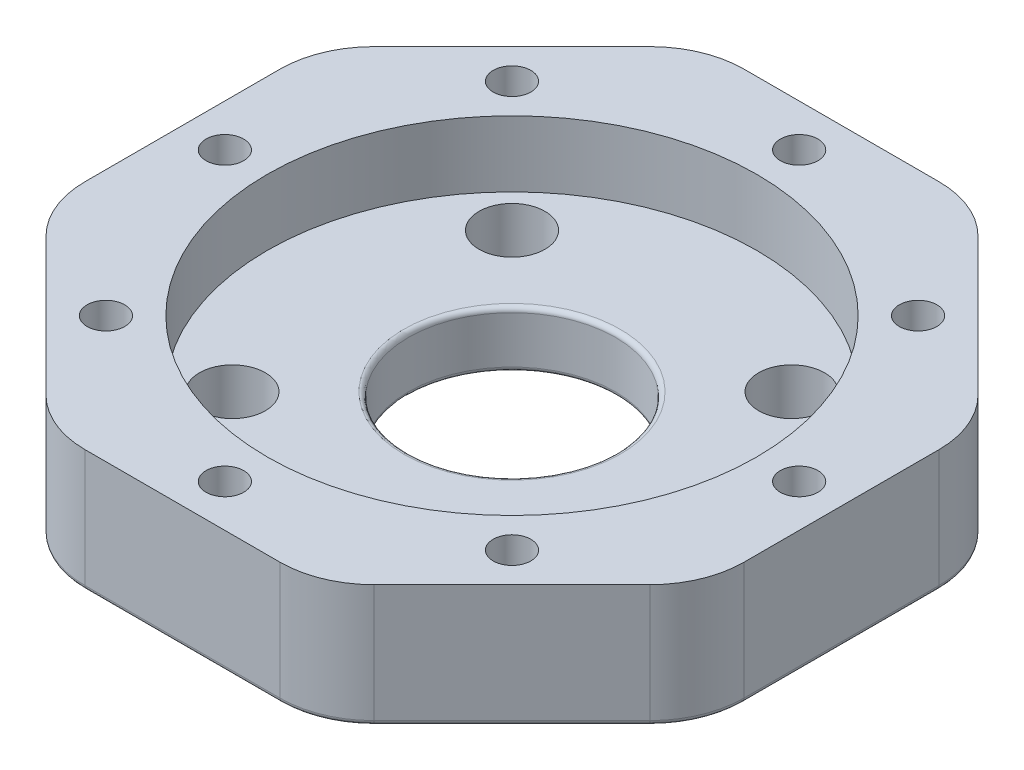
from build123d import *

# Parameters (mm, degrees)
SKETCH1_R           = 32
BOSS_EXTRUDE1_DEPTH = 13
SKETCH2_R           = 27
CUT_EXTRUDE1_DEPTH  = 7
SKETCH3_R           = 2.5
CUT_EXTRUDE2_DEPTH  = 46.793012567
SKETCH4_R           = 3.5
CUT_EXTRUDE3_DEPTH  = 5
BOSS_EXTRUDE2_START = 7
SKETCH7_R           = 27
SKETCH7_R_2         = 26
BOSS_EXTRUDE2_DEPTH = 7
SKETCH8_R           = 11
CUT_EXTRUDE6_DEPTH  = 46.793012567
FILLET2_R           = 0.5
SKETCH10_R          = 32
BOSS_EXTRUDE3_DEPTH = 13
SKETCH11_R          = 2
CUT_EXTRUDE9_DEPTH  = 52.176166328
FILLET3_R           = 0.5
SKETCH5_R           = 2
CUT_EXTRUDE11_DEPTH = 52.176166464
CUT_EXTRUDE12_DEPTH = 3


with BuildPart() as part:
    # Sketch1 → Boss-Extrude1 (new body)
    with BuildSketch(Plane(origin=(0, 0, 0), x_dir=(1, 0, 0), z_dir=(0, 1, 0))):
        with Locations(Location((0, 0, 0), (0, 0, 90))):
            Circle(SKETCH1_R)
    extrude(amount=BOSS_EXTRUDE1_DEPTH)

    # Sketch2 → Cut-Extrude1 (cut)
    with BuildSketch(Plane(origin=(0, 13, 0), x_dir=(1, 0, 0), z_dir=(0, 1, 0))):
        with Locations(Location((0, 0, 0), (0, 0, 270))):
            Circle(SKETCH2_R)
    extrude(amount=-CUT_EXTRUDE1_DEPTH, mode=Mode.SUBTRACT)

    # Sketch3 → Cut-Extrude2 (cut, through all)
    with BuildSketch(Plane(origin=(0, 6, 0), x_dir=(1, 0, 0), z_dir=(0, 1, 0))):
        with Locations(Location((-14.849242405, 14.849242405, 0), (0, 0, 270))):
            Circle(SKETCH3_R)
        with Locations(Location((14.849242405, 14.849242405, 0), (0, 0, 270))):
            Circle(SKETCH3_R)
        with Locations(Location((14.849242405, -14.849242405, 0), (0, 0, 270))):
            Circle(SKETCH3_R)
        with Locations(Location((-14.849242405, -14.849242405, 0), (0, 0, 270))):
            Circle(SKETCH3_R)
    extrude(amount=-CUT_EXTRUDE2_DEPTH, mode=Mode.SUBTRACT)

    # Sketch4 → Cut-Extrude3 (cut)
    with BuildSketch(Plane(origin=(0, 6, 0), x_dir=(1, 0, 0), z_dir=(0, 1, 0))):
        with Locations(Location((-14.849242405, 14.849242405, 0), (0, 0, 270))):
            Circle(SKETCH4_R)
        with Locations(Location((14.849242405, 14.849242405, 0), (0, 0, 270))):
            Circle(SKETCH4_R)
        with Locations(Location((14.849242405, -14.849242405, 0), (0, 0, 270))):
            Circle(SKETCH4_R)
        with Locations(Location((-14.849242405, -14.849242405, 0), (0, 0, 270))):
            Circle(SKETCH4_R)
    extrude(amount=-CUT_EXTRUDE3_DEPTH, mode=Mode.SUBTRACT)

    # Sketch7 → Boss-Extrude2 (add)
    with BuildSketch(Plane(origin=(0, 6, 0), x_dir=(1, 0, 0), z_dir=(0, 1, 0)).offset(BOSS_EXTRUDE2_START)):
        Circle(SKETCH7_R)
        with Locations(Location((0, 0, 0), (0, 0, 270))):
            Circle(SKETCH7_R_2, mode=Mode.SUBTRACT)
    extrude(amount=-BOSS_EXTRUDE2_DEPTH)

    # Sketch8 → Cut-Extrude6 (cut, through all)
    with BuildSketch(Plane(origin=(0, 6, 0), x_dir=(1, 0, 0), z_dir=(0, 1, 0))):
        with Locations(Location((0, 0, 0), (0, 0, 270))):
            Circle(SKETCH8_R)
    extrude(amount=-CUT_EXTRUDE6_DEPTH, mode=Mode.SUBTRACT)

    # Fillet2
    fillet2_edges = [part.edges().sort_by_distance(p)[0] for p in [
        (0, 0, -11),
        (0, 6, -11),
    ]]
    fillet(fillet2_edges, radius=FILLET2_R)

    # Sketch10 → Boss-Extrude3 (add)
    with BuildSketch(Plane(origin=(0, 0, 0), x_dir=(1, 0, 0), z_dir=(0, 1, 0))):
        with BuildLine():
            Line((10.355339059, 35), (-10.355339059, 35))
            ThreePointArc((-10.355339059, 35), (-14.182173383, 34.238795325), (-17.426406871, 32.071067812))
            Line((-17.426406871, 32.071067812), (-32.071067812, 17.426406871))
            ThreePointArc((-32.071067812, 17.426406871), (-34.238795325, 14.182173383), (-35, 10.355339059))
            Line((-35, 10.355339059), (-35, -10.355339059))
            ThreePointArc((-35, -10.355339059), (-34.238795325, -14.182173383), (-32.071067812, -17.426406871))
            Line((-32.071067812, -17.426406871), (-17.426406871, -32.071067812))
            ThreePointArc((-17.426406871, -32.071067812), (-14.182173383, -34.238795325), (-10.355339059, -35))
            Line((-10.355339059, -35), (10.355339059, -35))
            ThreePointArc((10.355339059, -35), (14.182173383, -34.238795325), (17.426406871, -32.071067812))
            Line((17.426406871, -32.071067812), (32.071067812, -17.426406871))
            ThreePointArc((32.071067812, -17.426406871), (34.238795325, -14.182173383), (35, -10.355339059))
            Line((35, -10.355339059), (35, 10.355339059))
            ThreePointArc((35, 10.355339059), (34.238795325, 14.182173383), (32.071067812, 17.426406871))
            Line((32.071067812, 17.426406871), (17.426406871, 32.071067812))
            ThreePointArc((17.426406871, 32.071067812), (14.182173383, 34.238795325), (10.355339059, 35))
        make_face()
        Circle(SKETCH10_R, mode=Mode.SUBTRACT)
    extrude(amount=BOSS_EXTRUDE3_DEPTH)

    # Sketch11 → Cut-Extrude9 (cut, through all)
    with BuildSketch(Plane(origin=(0, 13, 0), x_dir=(1, 0, 0), z_dir=(0, 1, 0))):
        with Locations(Location((-21.566756826, 21.566756826, 0), (0, 0, 270))):
            Circle(SKETCH11_R)
        with Locations(Location((21.566756826, 21.566756826, 0), (0, 0, 270))):
            Circle(SKETCH11_R)
        with Locations(Location((21.566756826, -21.566756826, 0), (0, 0, 270))):
            Circle(SKETCH11_R)
        with Locations(Location((-21.566756826, -21.566756826, 0), (0, 0, 270))):
            Circle(SKETCH11_R)
    extrude(amount=-CUT_EXTRUDE9_DEPTH, mode=Mode.SUBTRACT)

    # Fillet3
    fillet3_edges = [part.edges().sort_by_distance(p)[0] for p in [
        (-14.182173383, 0, 34.238795325),
        (0, 0, 35),
        (14.182173383, 0, 34.238795325),
        (24.748737342, 0, 24.748737342),
        (34.238795325, 0, 14.182173383),
        (35, 0, 0),
        (34.238795325, 0, -14.182173383),
        (24.748737342, 0, -24.748737342),
        (14.182173383, 0, -34.238795325),
        (0, 0, -35),
        (-14.182173383, 0, -34.238795325),
        (-24.748737342, 0, -24.748737342),
        (-34.238795325, 0, -14.182173383),
        (-35, 0, 0),
        (-34.238795325, 0, 14.182173383),
        (-24.748737342, 0, 24.748737342),
    ]]
    fillet(fillet3_edges, radius=FILLET3_R)

    # Sketch5 → Cut-Extrude11 (cut, through all)
    with BuildSketch(Plane(origin=(0, 13, 0), x_dir=(1, 0, 0), z_dir=(0, 1, 0))):
        with Locations(Location((0, 30.5, 0), (0, 0, 270))):
            Circle(SKETCH5_R)
        with Locations(Location((30.5, 0, 0), (0, 0, 270))):
            Circle(SKETCH5_R)
        with Locations(Location((0, -30.5, 0), (0, 0, 270))):
            Circle(SKETCH5_R)
        with Locations(Location((-30.5, 0, 0), (0, 0, 270))):
            Circle(SKETCH5_R)
    extrude(amount=-CUT_EXTRUDE11_DEPTH, mode=Mode.SUBTRACT)

    # Sketch12 → Cut-Extrude12 (cut)
    with BuildSketch(Plane.XZ):
        Polygon((-3.175426481, 30.5), (-1.58771324, 27.75), (1.58771324, 27.75), (3.175426481, 30.5), (1.58771324, 33.25), (-1.58771324, 33.25), align=None)
        Polygon((-30.5, -3.175426481), (-27.75, -1.58771324), (-27.75, 1.58771324), (-30.5, 3.175426481), (-33.25, 1.58771324), (-33.25, -1.58771324), align=None)
        Polygon((30.5, 3.175426481), (27.75, 1.58771324), (27.75, -1.58771324), (30.5, -3.175426481), (33.25, -1.58771324), (33.25, 1.58771324), align=None)
        Polygon((3.175426481, -30.5), (1.58771324, -27.75), (-1.58771324, -27.75), (-3.175426481, -30.5), (-1.58771324, -33.25), (1.58771324, -33.25), align=None)
    extrude(amount=-CUT_EXTRUDE12_DEPTH, mode=Mode.SUBTRACT)


solid = part.part
